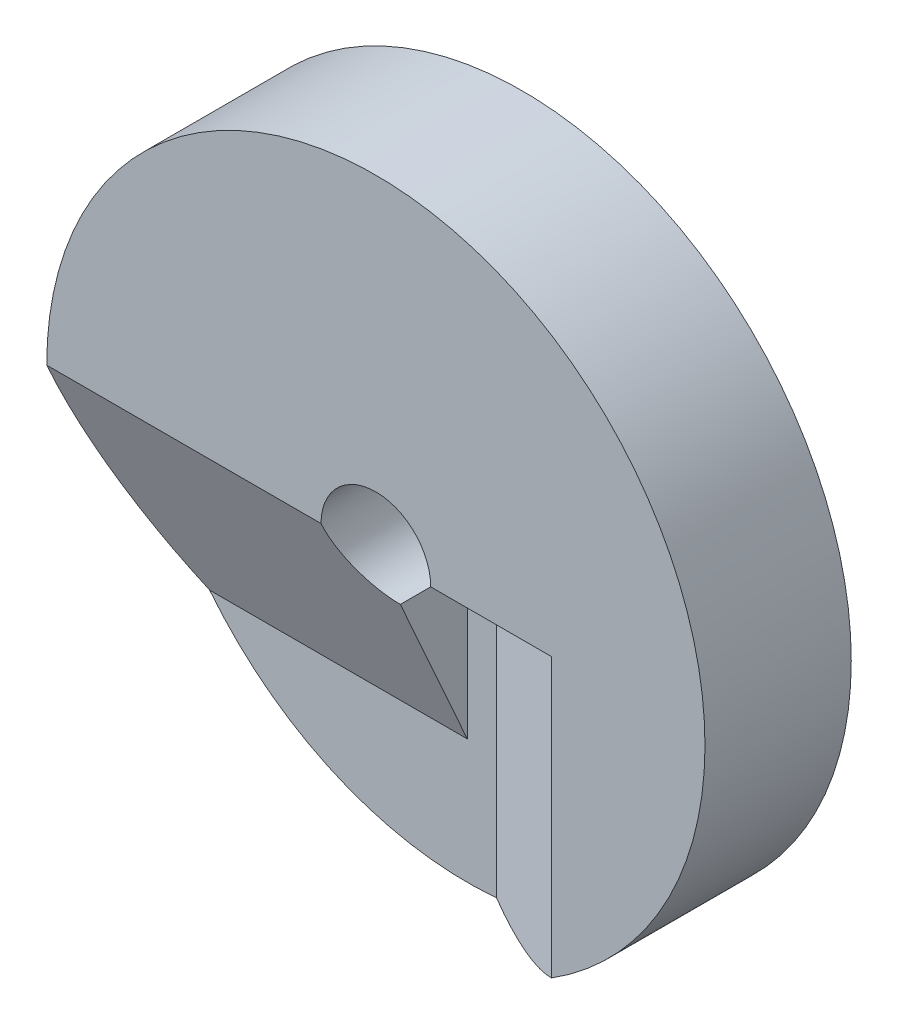
from build123d import *

# Parameters (mm, degrees)
CROQUIS1_R              = 9
CROQUIS1_R_2            = 1.5
SALIENTE_EXTRUIR1_DEPTH = 4
CORTAR_EXTRUIR1_DEPTH   = 15
CORTAR_EXTRUIR2_DEPTH   = 10


with BuildPart() as part:
    # Croquis1 → Saliente-Extruir1 (new body)
    with BuildSketch(Plane.XY):
        Circle(CROQUIS1_R)
        Circle(CROQUIS1_R_2, mode=Mode.SUBTRACT)
    extrude(amount=SALIENTE_EXTRUIR1_DEPTH)

    # Croquis2 → Cortar-Extruir1 (cut)
    with BuildSketch(Plane(origin=(0, 0, 0), x_dir=(0, 0, -1), z_dir=(1, 0, 0))):
        Polygon((-1.5, -5.6), (-4, 0), (-4, -9), (-1.5, -9), align=None)
    extrude(amount=-CORTAR_EXTRUIR1_DEPTH, mode=Mode.SUBTRACT)

    # Croquis3 → Cortar-Extruir2 (cut)
    with BuildSketch(Plane(origin=(0, 0, 0), x_dir=(1, 0, 0), z_dir=(0, 1, 0))):
        Polygon((0, -1.5), (0, -4), (4.803477962, -4), (0.798212, -1.5), align=None)
    extrude(amount=-CORTAR_EXTRUIR2_DEPTH, mode=Mode.SUBTRACT)


solid = part.part
